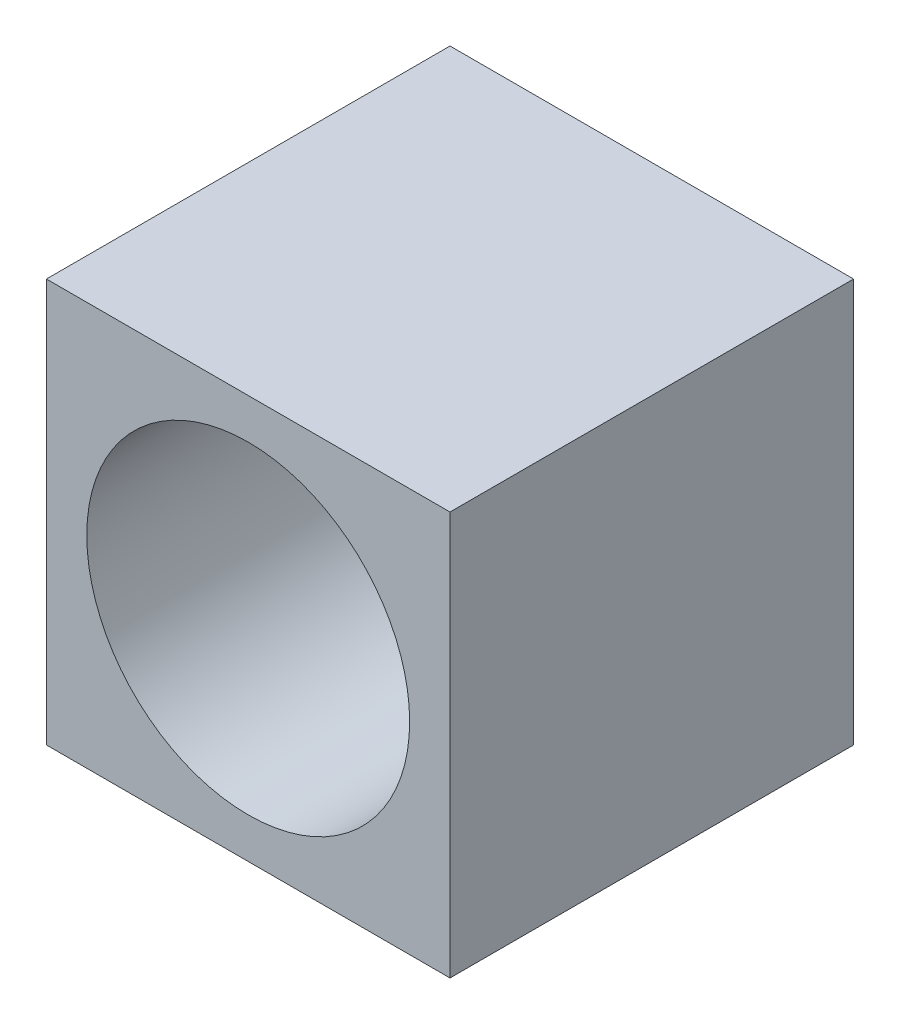
from build123d import *

# Parameters (mm, degrees)
CROQUIS2_W              = 10
CROQUIS2_H              = 10
CROQUIS2_R              = 4
SALIENTE_EXTRUIR1_DEPTH = 10


with BuildPart() as part:
    # Croquis2 → Saliente-Extruir1 (new body)
    with BuildSketch(Plane.XY):
        Rectangle(CROQUIS2_W, CROQUIS2_H)
        Circle(CROQUIS2_R, mode=Mode.SUBTRACT)
    extrude(amount=SALIENTE_EXTRUIR1_DEPTH)


solid = part.part
